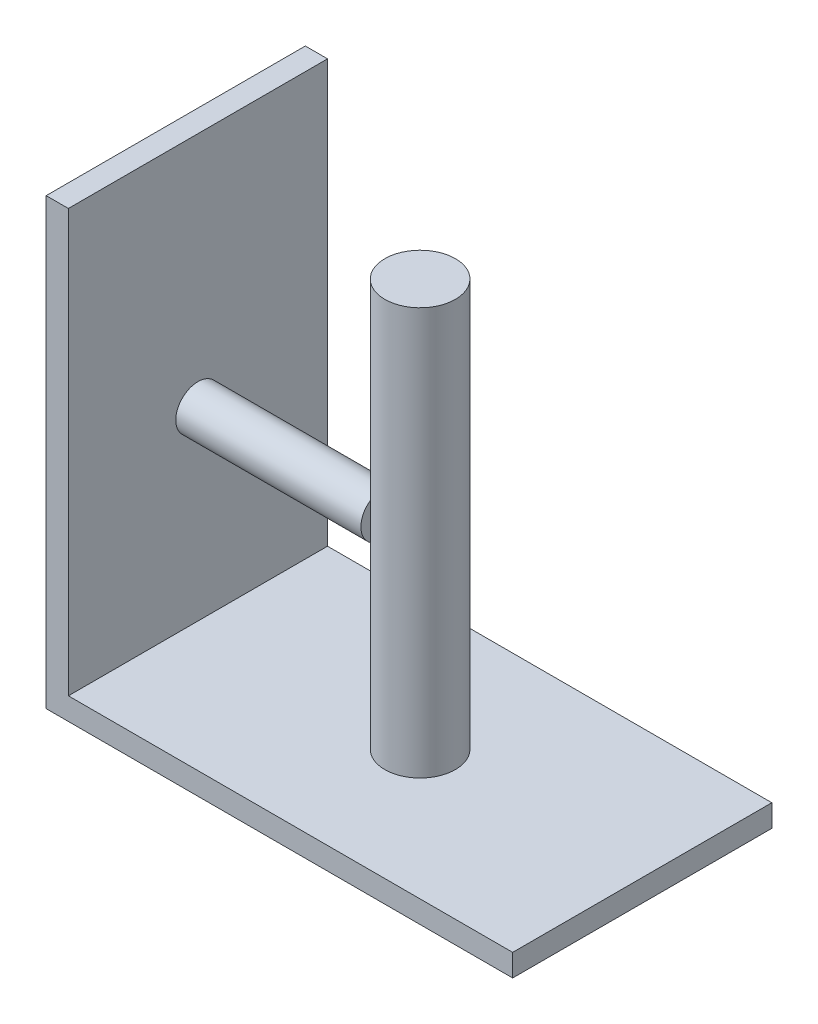
from build123d import *

# Parameters (mm, degrees)
CROQUIS1_W              = 3
CROQUIS1_H              = 57
SALIENTE_EXTRUIR1_DEPTH = 17.5
CROQUIS2_R              = 3
SALIENTE_EXTRUIR2_DEPTH = 25
CROQUIS3_R              = 4.7625
SALIENTE_EXTRUIR3_DEPTH = 55


with BuildPart() as part:
    # Croquis1 → Saliente-Extruir1 (new, symmetric)
    with BuildSketch(Plane.XY):
        with Locations((1.5, 28.5)):
            Rectangle(CROQUIS1_W, CROQUIS1_H)
        Polygon((3, 0), (0, 0), (0, -3), (63, -3), (63, 0), align=None)
    extrude(amount=SALIENTE_EXTRUIR1_DEPTH, both=True)

    # Croquis2 → Saliente-Extruir2 (add)
    with BuildSketch(Plane(origin=(3, 0, 0), x_dir=(0, 0, -1), z_dir=(1, 0, 0))):
        with Locations(Location((0, 25, 0), (0, 0, 180))):
            Circle(CROQUIS2_R)
    extrude(amount=SALIENTE_EXTRUIR2_DEPTH)

    # Croquis3 → Saliente-Extruir3 (add)
    with BuildSketch(Plane(origin=(0, 0, 0), x_dir=(1, 0, 0), z_dir=(0, 1, 0))):
        with Locations(Location((33, 0, 0), (0, 0, 270))):
            Circle(CROQUIS3_R)
    extrude(amount=SALIENTE_EXTRUIR3_DEPTH)


solid = part.part
